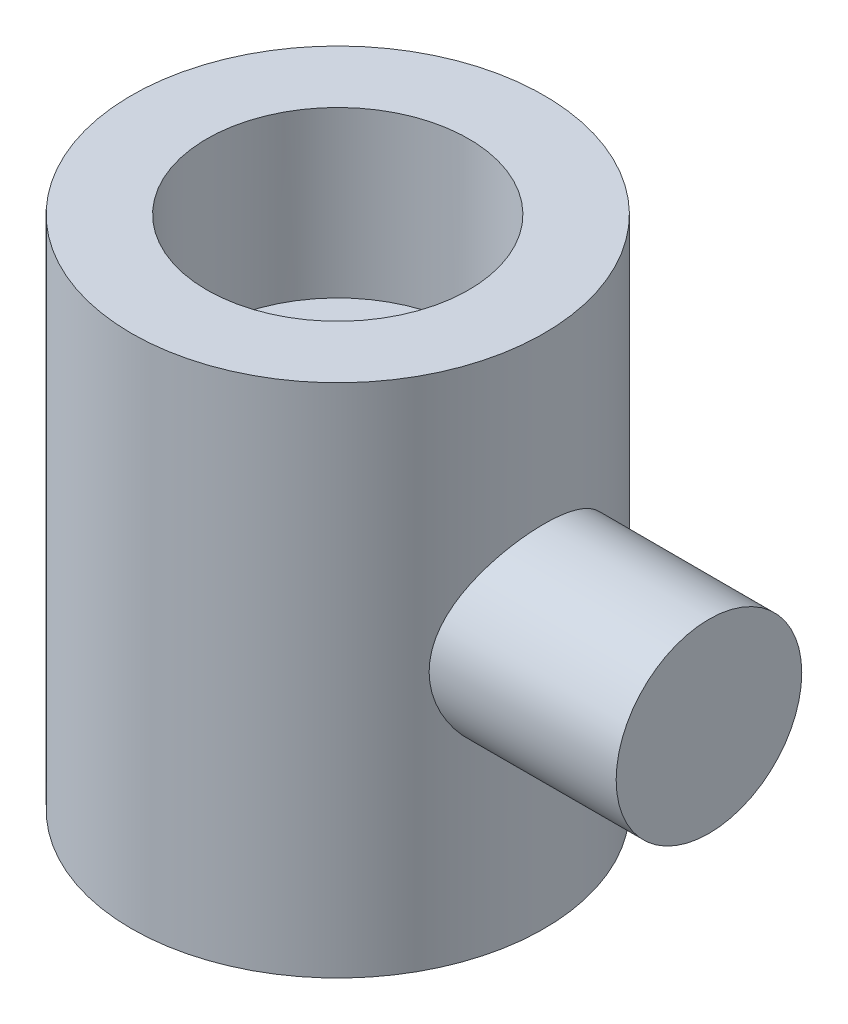
from build123d import *

# Parameters (mm, degrees)
SKETCH2_R           = 10
BOSS_EXTRUDE1_DEPTH = 25
SKETCH3_R           = 4.5
BOSS_EXTRUDE2_DEPTH = 18
SKETCH7_R           = 6.35
CUT_EXTRUDE2_DEPTH  = 33.388269645
SKETCH8_W           = 15
SKETCH8_H           = 9
BOSS_EXTRUDE3_DEPTH = 6.5


with BuildPart() as part:
    # Sketch2 → Boss-Extrude1 (new body)
    with BuildSketch(Plane(origin=(0, 0, 0), x_dir=(1, 0, 0), z_dir=(0, 1, 0))):
        with Locations(Location((0, 0, 0), (0, 0, 270))):
            Circle(SKETCH2_R)
    extrude(amount=BOSS_EXTRUDE1_DEPTH)

    # Sketch3 → Boss-Extrude2 (add)
    with BuildSketch(Plane(origin=(0, 0, 0), x_dir=(0, 0, -1), z_dir=(1, 0, 0))):
        with Locations(Location((0, 12.5, 0), (0, 0, 180))):
            Circle(SKETCH3_R)
    extrude(amount=BOSS_EXTRUDE2_DEPTH)

    # Sketch7 → Cut-Extrude2 (cut, through all)
    with BuildSketch(Plane(origin=(0, 25, 0), x_dir=(1, 0, 0), z_dir=(0, 1, 0))):
        with Locations(Location((0, 0, 0), (0, 0, 270))):
            Circle(SKETCH7_R)
    extrude(amount=-CUT_EXTRUDE2_DEPTH, mode=Mode.SUBTRACT)

    # Sketch8 → Boss-Extrude3 (add, symmetric)
    with BuildSketch(Plane.XY):
        with Locations((0, 12.5)):
            Rectangle(SKETCH8_W, SKETCH8_H)
    extrude(amount=BOSS_EXTRUDE3_DEPTH, both=True)


solid = part.part
